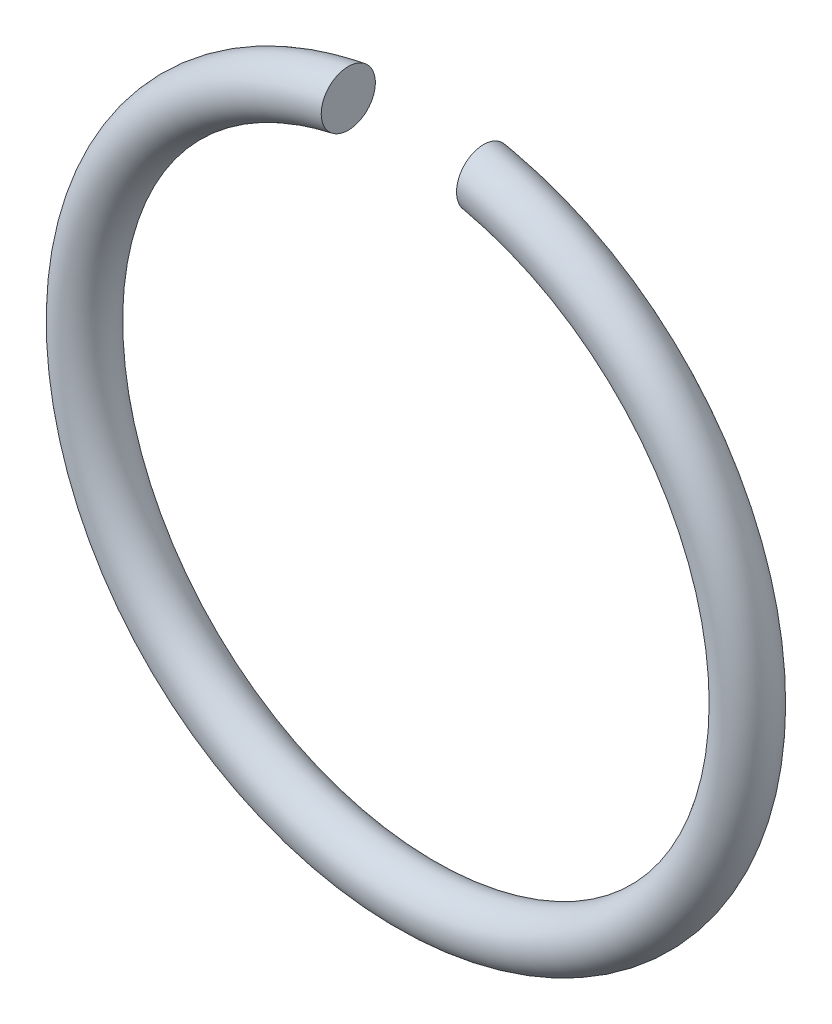
from build123d import *

# Parameters (mm, degrees)
SKETCH2_R               = 0.4
CUT_EXTRUDE1_DEPTH      = 8.505997748
CUT_EXTRUDE1_DEPTH_BACK = 8.505997748
SKETCH3_W               = 2
SKETCH3_H               = 5.3


with BuildPart() as part:
    # Base-Sweep: sweep along a path in Sketch1
    with BuildLine(Plane.XY) as base_sweep_path:
        CenterArc((0, 0), 4.9, 0, 360)
    # Sketch2 → Base-Sweep (sweep)
    with BuildSketch(Plane(origin=(0, 0, 0), x_dir=(1, 0, 0), z_dir=(0, 1, 0))):
        with Locations((4.9, 0)):
            Circle(SKETCH2_R)
    sweep(path=base_sweep_path.line)

    # Sketch3 → Cut-Extrude1 (cut, two sides: drawn at the far end of the back side and taken through both)
    with BuildSketch(Plane.XY.offset(-CUT_EXTRUDE1_DEPTH_BACK)):
        with Locations((0, 2.65)):
            Rectangle(SKETCH3_W, SKETCH3_H)
    extrude(amount=CUT_EXTRUDE1_DEPTH + CUT_EXTRUDE1_DEPTH_BACK, mode=Mode.SUBTRACT)


solid = part.part
